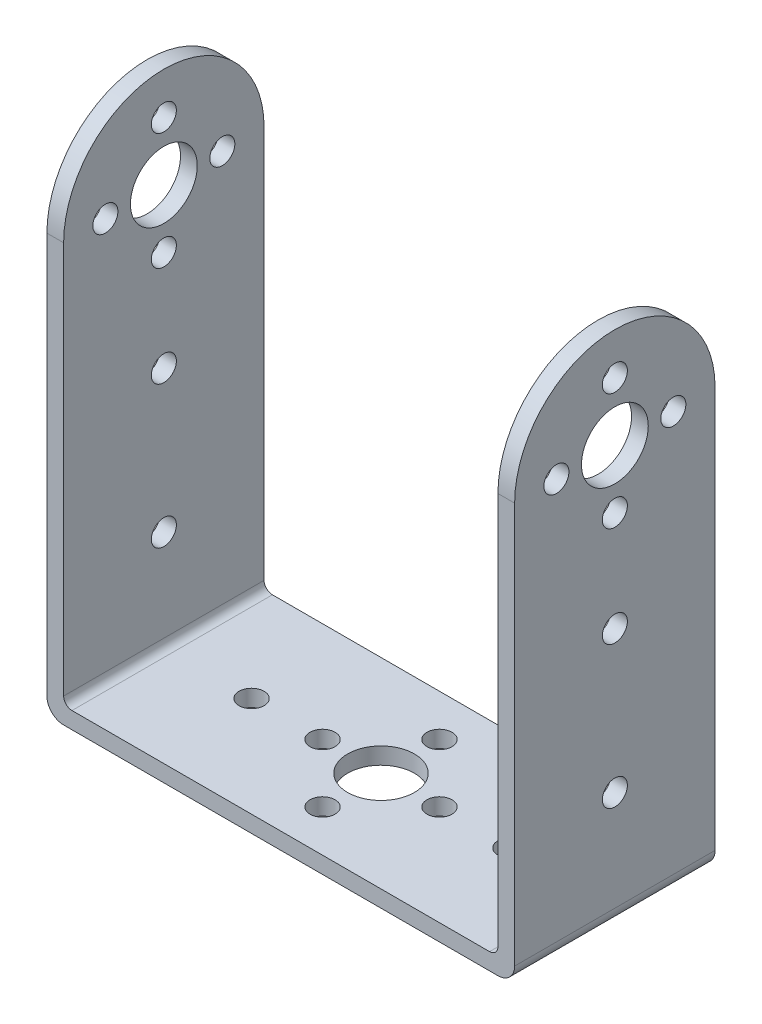
from build123d import *

# Parameters (mm, degrees)
SKETCH1_W           = 52
SKETCH1_H           = 24
SKETCH1_R           = 4
SKETCH1_R_2         = 1.5
BOSS_EXTRUDE1_DEPTH = 2
SKETCH3_R           = 4
SKETCH3_R_2         = 1.5
BOSS_EXTRUDE2_DEPTH = 2
FILLET1_R           = 2
FILLET2_R           = 1
BOSS_EXTRUDE3_START = 2
SKETCH5_R           = 4
SKETCH5_R_2         = 1.5
BOSS_EXTRUDE3_DEPTH = 2
FILLET3_R           = 2
FILLET4_R           = 1


with BuildPart() as part:
    # Sketch1 → Boss-Extrude1 (new body)
    with BuildSketch(Plane(origin=(0, 0, 0), x_dir=(1, 0, 0), z_dir=(0, 1, 0))):
        Rectangle(SKETCH1_W, SKETCH1_H)
        with Locations(Location((0, 0, 0), (0, 0, 270))):
            Circle(SKETCH1_R, mode=Mode.SUBTRACT)
        with Locations(Location((0, 7, 0), (0, 0, 270))):
            Circle(SKETCH1_R_2, mode=Mode.SUBTRACT)
        with Locations(Location((0, -7, 0), (0, 0, 270))):
            Circle(SKETCH1_R_2, mode=Mode.SUBTRACT)
        with Locations(Location((7, 0, 0), (0, 0, 270))):
            Circle(SKETCH1_R_2, mode=Mode.SUBTRACT)
        with Locations(Location((-7, 0, 0), (0, 0, 270))):
            Circle(SKETCH1_R_2, mode=Mode.SUBTRACT)
        with Locations(Location((-15.5, 0, 0), (0, 0, 270))):
            Circle(SKETCH1_R_2, mode=Mode.SUBTRACT)
        with Locations(Location((15.5, 0, 0), (0, 0, 270))):
            Circle(SKETCH1_R_2, mode=Mode.SUBTRACT)
    extrude(amount=BOSS_EXTRUDE1_DEPTH)

    # Sketch3 → Boss-Extrude2 (add)
    with BuildSketch(Plane(origin=(26, 0, 0), x_dir=(0, 0, -1), z_dir=(1, 0, 0))):
        with BuildLine():
            Line((-12, 0), (12, 0))
            Line((12, 0), (12, 50))
            ThreePointArc((12, 50), (0, 62), (-12, 50))
            Line((-12, 50), (-12, 0))
        make_face()
        with Locations((0, 50)):
            Circle(SKETCH3_R, mode=Mode.SUBTRACT)
        with Locations((0, 57)):
            Circle(SKETCH3_R_2, mode=Mode.SUBTRACT)
        with Locations((7, 50)):
            Circle(SKETCH3_R_2, mode=Mode.SUBTRACT)
        with Locations((0, 43)):
            Circle(SKETCH3_R_2, mode=Mode.SUBTRACT)
        with Locations((-7, 50)):
            Circle(SKETCH3_R_2, mode=Mode.SUBTRACT)
        with Locations((0, 31)):
            Circle(SKETCH3_R_2, mode=Mode.SUBTRACT)
        with Locations((0, 14)):
            Circle(SKETCH3_R_2, mode=Mode.SUBTRACT)
    extrude(amount=BOSS_EXTRUDE2_DEPTH)

    # Fillet1
    fillet1_edges = [part.edges().sort_by_distance(p)[0] for p in [
        (28, 0, 0),
    ]]
    fillet(fillet1_edges, radius=FILLET1_R)

    # Fillet2
    fillet2_edges = [part.edges().sort_by_distance(p)[0] for p in [
        (26, 2, 0),
    ]]
    fillet(fillet2_edges, radius=FILLET2_R)

    # Sketch5 → Boss-Extrude3 (add)
    with BuildSketch(Plane.ZY.offset(26).offset(BOSS_EXTRUDE3_START)):
        with BuildLine():
            Line((-12, 0), (-12, 50))
            ThreePointArc((-12, 50), (0, 62), (12, 50))
            Line((12, 50), (12, 0))
            Line((12, 0), (-12, 0))
        make_face()
        with Locations(Location((0, 50, 0), (0, 0, 180))):
            Circle(SKETCH5_R, mode=Mode.SUBTRACT)
        with Locations(Location((0, 57, 0), (0, 0, 180))):
            Circle(SKETCH5_R_2, mode=Mode.SUBTRACT)
        with Locations(Location((0, 43, 0), (0, 0, 180))):
            Circle(SKETCH5_R_2, mode=Mode.SUBTRACT)
        with Locations(Location((7, 50, 0), (0, 0, 180))):
            Circle(SKETCH5_R_2, mode=Mode.SUBTRACT)
        with Locations(Location((-7, 50, 0), (0, 0, 180))):
            Circle(SKETCH5_R_2, mode=Mode.SUBTRACT)
        with Locations(Location((0, 31, 0), (0, 0, 180))):
            Circle(SKETCH5_R_2, mode=Mode.SUBTRACT)
        with Locations(Location((0, 14, 0), (0, 0, 180))):
            Circle(SKETCH5_R_2, mode=Mode.SUBTRACT)
    extrude(amount=-BOSS_EXTRUDE3_DEPTH)

    # Fillet3
    fillet3_edges = [part.edges().sort_by_distance(p)[0] for p in [
        (-28, 0, 0),
    ]]
    fillet(fillet3_edges, radius=FILLET3_R)

    # Fillet4
    fillet4_edges = [part.edges().sort_by_distance(p)[0] for p in [
        (-26, 2, 0),
    ]]
    fillet(fillet4_edges, radius=FILLET4_R)


solid = part.part
